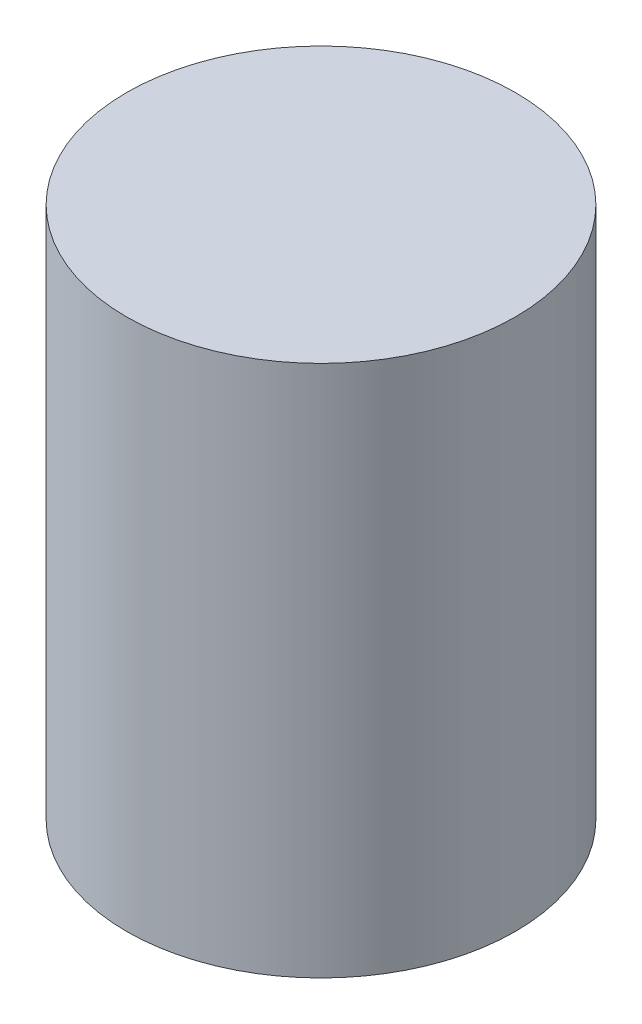
from build123d import *

# Parameters (mm, degrees)
SZKIC1_R                    = 5.5
DODANIE_WYCI_GNI_CIE1_DEPTH = 15.06


with BuildPart() as part:
    # Szkic1 → Dodanie-wyciągnięcie1 (new body)
    with BuildSketch(Plane(origin=(0, 0, 0), x_dir=(1, 0, 0), z_dir=(0, 1, 0))):
        with Locations(Location((0, 0, 0), (0, 0, 270))):
            Circle(SZKIC1_R)
    extrude(amount=DODANIE_WYCI_GNI_CIE1_DEPTH)


solid = part.part
